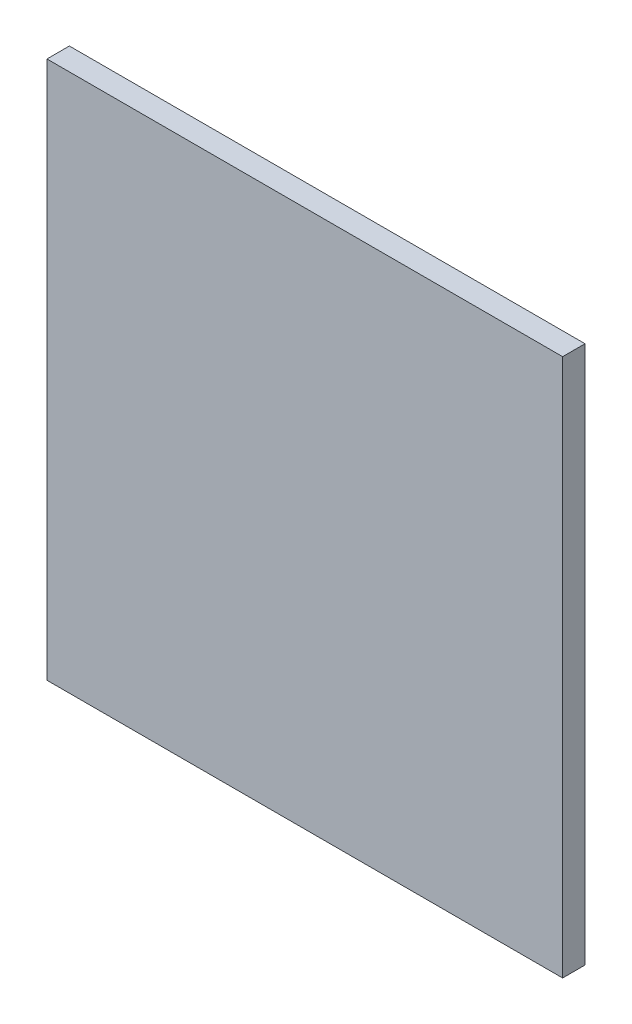
from build123d import *

# Parameters (mm, degrees)
SKETCH1_W           = 115
SKETCH1_H           = 120
BOSS_EXTRUDE1_DEPTH = 5


with BuildPart() as part:
    # Sketch1 → Boss-Extrude1 (new body)
    with BuildSketch(Plane.XY):
        with Locations((0, 60)):
            Rectangle(SKETCH1_W, SKETCH1_H)
    extrude(amount=BOSS_EXTRUDE1_DEPTH)


solid = part.part
